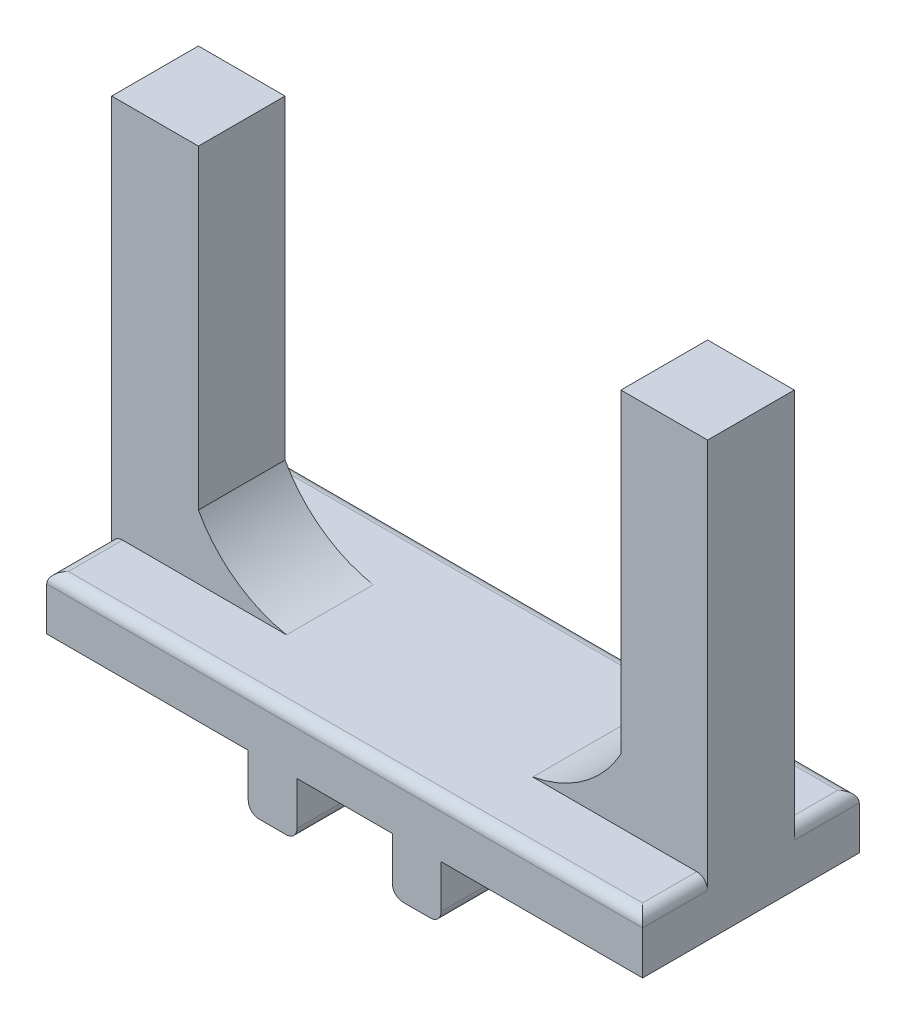
from build123d import *

# Parameters (mm, degrees)
SKETCH1_W           = 55
SKETCH1_H           = 5
SKETCH1_W_2         = 4.5
BOSS_EXTRUDE2_DEPTH = 20
SKETCH2_W           = 8
SKETCH2_H           = 8
BOSS_EXTRUDE3_DEPTH = 35
FILLET1_R           = 1
BOSS_EXTRUDE4_DEPTH = 4


with BuildPart() as part:
    # Sketch1 → Boss-Extrude2 (new body)
    with BuildSketch(Plane.XY):
        Rectangle(SKETCH1_W, SKETCH1_H)
        with Locations((-6.65, -5)):
            Rectangle(SKETCH1_W_2, SKETCH1_H)
        with Locations((6.65, -5)):
            Rectangle(SKETCH1_W_2, SKETCH1_H)
    extrude(amount=BOSS_EXTRUDE2_DEPTH)

    # Sketch2 → Boss-Extrude3 (add)
    with BuildSketch(Plane(origin=(0, 2.5, 0), x_dir=(1, 0, 0), z_dir=(0, 1, 0))):
        with Locations((23.5, -10)):
            Rectangle(SKETCH2_W, SKETCH2_H)
        with Locations((-23.5, -10)):
            Rectangle(SKETCH2_W, SKETCH2_H)
    extrude(amount=BOSS_EXTRUDE3_DEPTH)

    # Fillet1
    fillet1_edges = [part.edges().sort_by_distance(p)[0] for p in [
        (0, 2.5, 20),
        (0, 2.5, 0),
        (8.9, -7.5, 10),
        (4.4, -7.5, 10),
        (-4.4, -7.5, 10),
        (-8.9, -7.5, 10),
        (-27.5, 2.5, 17),
        (27.5, 2.5, 17),
        (-27.5, 2.5, 3),
        (27.5, 2.5, 3),
    ]]
    fillet(fillet1_edges, radius=FILLET1_R)

    # Sketch9 → Boss-Extrude4 (add, symmetric)
    with BuildSketch(Plane.XY.offset(10)):
        with BuildLine():
            Line((-19.5, 8.405065213), (-19.5, 2.5))
            Line((-19.5, 2.5), (-11.364093889, 2.5))
            ThreePointArc((-11.364093889, 2.5), (-16.092079197, 4.543150534), (-19.5, 8.405065213))
        make_face()
    boss_extrude4 = extrude(amount=BOSS_EXTRUDE4_DEPTH, both=True)

    # Mirror1: Boss-Extrude4 across plane
    add(boss_extrude4.mirror(Plane(origin=(0, 0, 0), x_dir=(0, 0, 1), z_dir=(1, 0, 0))))


solid = part.part
